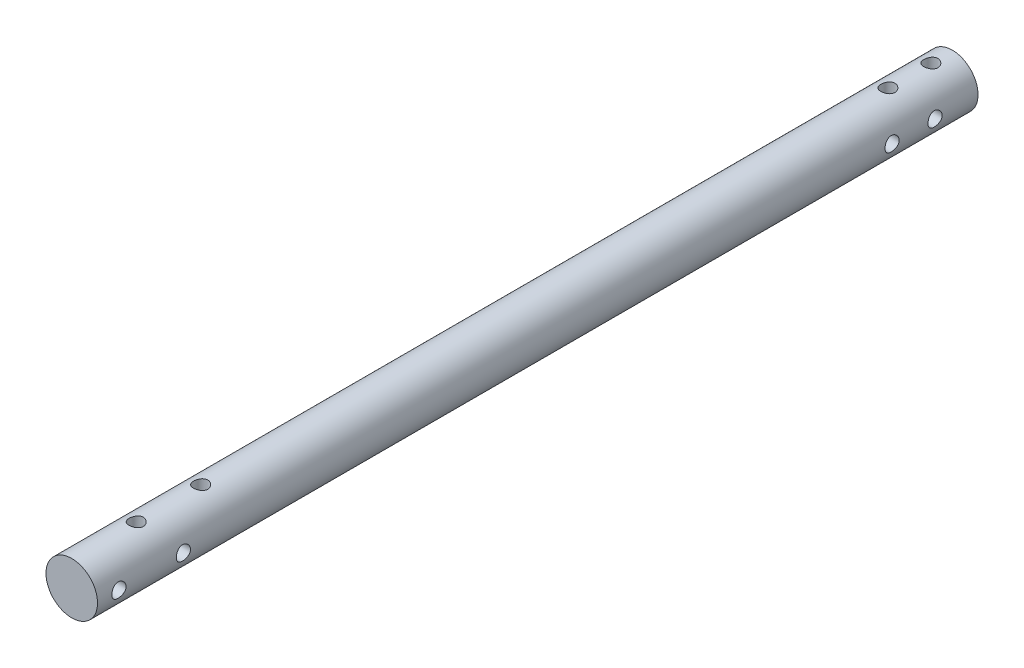
from build123d import *

# Parameters (mm, degrees)
SKETCH_1_W               = 8
SKETCH_1_H               = 8
SKETCH_1_W_2             = 4
SKETCH_1_H_2             = 4
EXTRUDE_1_DEPTH          = 205
SKETCH_7_R               = 6
EXTRUDE_2_DEPTH          = 205
CUT_EXTRUDE_1_DEPTH      = 206.175534604
CUT_EXTRUDE_1_DEPTH_BACK = 206.175534604
SKETCH_2_R               = 1.65
CUT_EXTRUDE_2_DEPTH      = 206.17553471
CUT_EXTRUDE_2_DEPTH_BACK = 206.17553471
SKETCH_3_R               = 1.65
CUT_EXTRUDE_3_DEPTH      = 206.17553471
CUT_EXTRUDE_3_DEPTH_BACK = 206.17553471
SKETCH_4_R               = 1.65
CUT_EXTRUDE_4_DEPTH      = 206.17553471
CUT_EXTRUDE_4_DEPTH_BACK = 206.17553471
SKETCH_5_R               = 1.65


with BuildPart() as part:
    # 草图1 → 凸台-拉伸1 (new body)
    with BuildSketch(Plane.XY):
        Rectangle(SKETCH_1_W, SKETCH_1_H)
        Rectangle(SKETCH_1_W_2, SKETCH_1_H_2, mode=Mode.SUBTRACT)
    extrude(amount=EXTRUDE_1_DEPTH)

    # 草图7 → 凸台-拉伸2 (add)
    with BuildSketch(Plane(origin=(0, 0, 0), x_dir=(-1, 0, 0), z_dir=(0, 0, -1))):
        Circle(SKETCH_7_R)
    extrude(amount=-EXTRUDE_2_DEPTH)

    # 草图2 → 切除-拉伸1 (cut, two sides: drawn at the far end of the back side and taken through both)
    with BuildSketch(Plane(origin=(0, 0, 0), x_dir=(1, 0, 0), z_dir=(0, 1, 0)).offset(-CUT_EXTRUDE_1_DEPTH_BACK)):
        with Locations(Location((0, -5, 0), (0, 0, 270))):
            Circle(SKETCH_2_R)
        with Locations(Location((0, -15, 0), (0, 0, 270))):
            Circle(SKETCH_2_R)
    extrude(amount=CUT_EXTRUDE_1_DEPTH + CUT_EXTRUDE_1_DEPTH_BACK, mode=Mode.SUBTRACT)

    # 草图3 → 切除-拉伸2 (cut, two sides: drawn at the far end of the back side and taken through both)
    with BuildSketch(Plane.ZY.offset(-CUT_EXTRUDE_2_DEPTH_BACK)):
        with Locations((10, 0)):
            Circle(SKETCH_3_R)
        with Locations((20, 0)):
            Circle(SKETCH_3_R)
    extrude(amount=CUT_EXTRUDE_2_DEPTH + CUT_EXTRUDE_2_DEPTH_BACK, mode=Mode.SUBTRACT)

    # 草图4 → 切除-拉伸3 (cut, two sides: drawn at the far end of the back side and taken through both)
    with BuildSketch(Plane.ZY.offset(-CUT_EXTRUDE_3_DEPTH_BACK)):
        with Locations((200, 0)):
            Circle(SKETCH_4_R)
        with Locations((185, 0)):
            Circle(SKETCH_4_R)
    extrude(amount=CUT_EXTRUDE_3_DEPTH + CUT_EXTRUDE_3_DEPTH_BACK, mode=Mode.SUBTRACT)

    # 草图5 → 切除-拉伸4 (cut, two sides: drawn at the far end of the back side and taken through both)
    with BuildSketch(Plane(origin=(0, 0, 0), x_dir=(1, 0, 0), z_dir=(0, 1, 0)).offset(-CUT_EXTRUDE_4_DEPTH_BACK)):
        with Locations(Location((0, -190, 0), (0, 0, 270))):
            Circle(SKETCH_5_R)
        with Locations(Location((0, -175, 0), (0, 0, 270))):
            Circle(SKETCH_5_R)
    extrude(amount=CUT_EXTRUDE_4_DEPTH + CUT_EXTRUDE_4_DEPTH_BACK, mode=Mode.SUBTRACT)


solid = part.part
